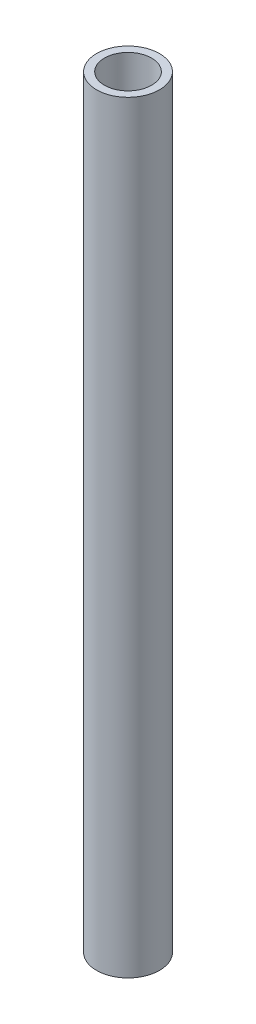
from build123d import *

# Parameters (mm, degrees)
SKETCH_1_R      = 4
SKETCH_1_R_2    = 3
EXTRUDE_1_DEPTH = 97


with BuildPart() as part:
    # Эскиз1 → Бобышка-Вытянуть1 (new body)
    with BuildSketch(Plane(origin=(0, 0, 0), x_dir=(1, 0, 0), z_dir=(0, 1, 0))):
        with Locations(Location((0, 0, 0), (0, 0, 90))):
            Circle(SKETCH_1_R)
        with Locations(Location((0, 0, 0), (0, 0, 90))):
            Circle(SKETCH_1_R_2, mode=Mode.SUBTRACT)
    extrude(amount=EXTRUDE_1_DEPTH)


solid = part.part
